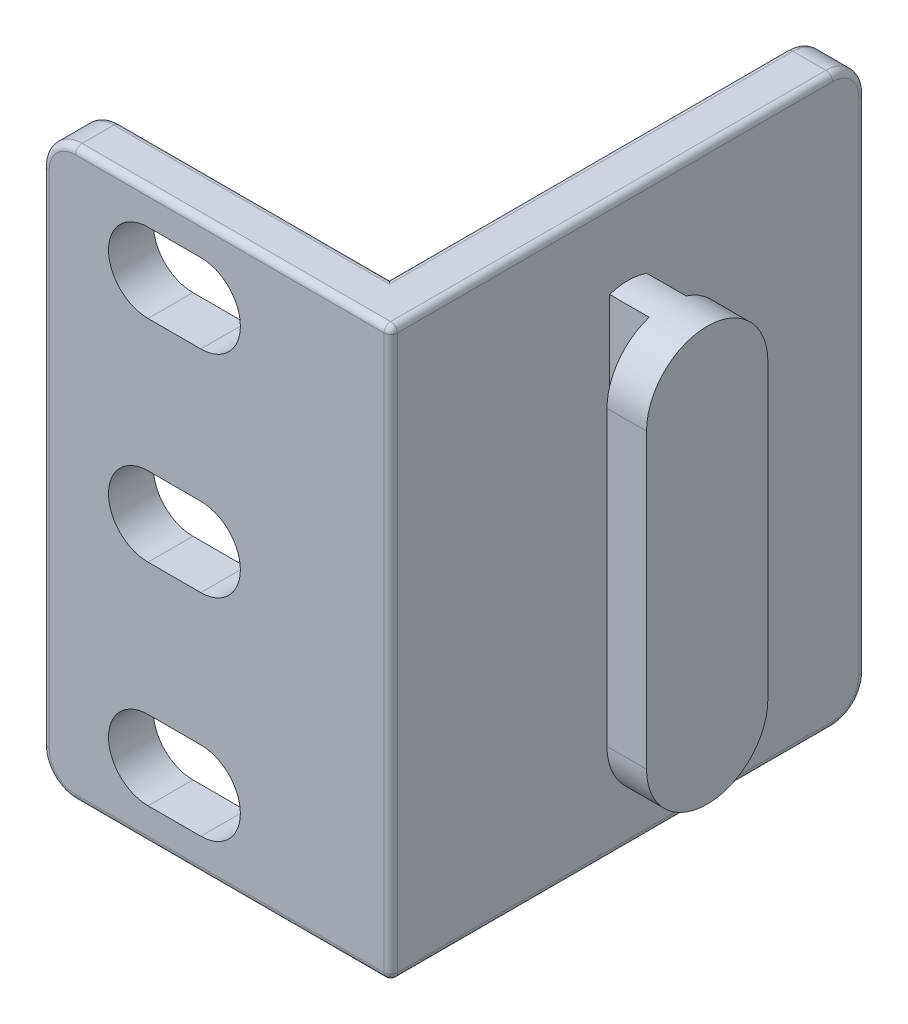
from build123d import *

# Parameters (mm, degrees)
P_IDAT_VYSUNUT_M1_DEPTH  = 21.5
P_IDAT_VYSUNUT_M2_DEPTH  = 3
P_IDAT_VYSUNUT_M3_DEPTH  = 3
ODEBRAT_VYSUNUT_M1_DEPTH = 50.550075681
ZAOBLIT1_R               = 2.5
ZAOBLIT2_R               = 0.5


with BuildPart() as part:
    # Skica2 → Přidat vysunutím1 (new, symmetric)
    with BuildSketch(Plane(origin=(0, 0, 0), x_dir=(1, 0, 0), z_dir=(0, 1, 0))):
        Polygon((0, 0), (-26.4, 0), (-26.4, 3.4), (-3.5, 3.4), (-3.5, 36), (0, 36), align=None)
    extrude(amount=P_IDAT_VYSUNUT_M1_DEPTH, both=True)

    # Skica3 → Přidat vysunutím2 (add)
    with BuildSketch(Plane(origin=(0, 0, 0), x_dir=(0, 0, -1), z_dir=(1, 0, 0))):
        with BuildLine():
            Line((16.6, 15.48178046), (16.6, -15.48178046))
            ThreePointArc((16.6, -15.48178046), (18, -15.7), (19.4, -15.48178046))
            Line((19.4, -15.48178046), (19.4, 15.48178046))
            ThreePointArc((19.4, 15.48178046), (18, 15.7), (16.6, 15.48178046))
        make_face()
    extrude(amount=P_IDAT_VYSUNUT_M2_DEPTH)

    # Skica4 → Přidat vysunutím3 (add)
    with BuildSketch(Plane(origin=(3, 0, 0), x_dir=(0, 0, -1), z_dir=(1, 0, 0))):
        with BuildLine():
            Line((13.4, -11.1), (13.4, 11.1))
            ThreePointArc((13.4, 11.1), (18, 15.7), (22.6, 11.1))
            Line((22.6, 11.1), (22.6, -11.1))
            ThreePointArc((22.6, -11.1), (18, -15.7), (13.4, -11.1))
        make_face()
    extrude(amount=P_IDAT_VYSUNUT_M3_DEPTH)

    # Skica5 → Odebrat vysunutím1 (cut, through all)
    with BuildSketch(Plane.XY):
        with BuildLine():
            Line((-14.400164981, -3), (-18.399835019, -3))
            ThreePointArc((-18.399835019, -3), (-21.399835019, 0), (-18.399835019, 3))
            Line((-18.399835019, 3), (-14.400164981, 3))
            ThreePointArc((-14.400164981, 3), (-11.400164981, 0), (-14.400164981, -3))
        make_face()
        with BuildLine():
            Line((-14.400164981, 13), (-18.399835019, 13))
            ThreePointArc((-18.399835019, 13), (-21.399835019, 16), (-18.399835019, 19))
            Line((-18.399835019, 19), (-14.400164981, 19))
            ThreePointArc((-14.400164981, 19), (-11.400164981, 16), (-14.400164981, 13))
        make_face()
        with BuildLine():
            Line((-14.400164981, -19), (-18.399835019, -19))
            ThreePointArc((-18.399835019, -19), (-21.399835019, -16), (-18.399835019, -13))
            Line((-18.399835019, -13), (-14.400164981, -13))
            ThreePointArc((-14.400164981, -13), (-11.400164981, -16), (-14.400164981, -19))
        make_face()
    extrude(amount=-ODEBRAT_VYSUNUT_M1_DEPTH, mode=Mode.SUBTRACT)

    # Zaoblit1
    zaoblit1_edges = [part.edges().sort_by_distance(p)[0] for p in [
        (-26.4, 21.5, -1.7),
        (-26.4, -21.5, -1.7),
        (-1.75, 21.5, -36),
        (-1.75, -21.5, -36),
    ]]
    fillet(zaoblit1_edges, radius=ZAOBLIT1_R)

    # Zaoblit2
    zaoblit2_edges = [part.edges().sort_by_distance(p)[0] for p in [
        (0, 0, 0),
        (-26.4, 0, 0),
        (-26.4, 0, -3.4),
        (-11.95, -21.5, 0),
        (-11.95, 21.5, 0),
        (-25.667766953, 20.767766953, 0),
        (-25.667766953, -20.767766953, 0),
        (-3.5, -21.5, -18.45),
        (-25.667766953, 20.767766953, -3.4),
        (-25.667766953, -20.767766953, -3.4),
        (-3.5, 21.5, -18.45),
        (-3.5, 0, -36),
        (0, 0, -36),
        (-3.5, 20.767766953, -35.267766953),
        (-3.5, -20.767766953, -35.267766953),
        (0, 20.767766953, -35.267766953),
        (0, -20.767766953, -35.267766953),
        (-13.7, 21.5, -3.4),
        (0, 21.5, -16.75),
        (-13.7, -21.5, -3.4),
        (0, -21.5, -16.75),
    ]]
    fillet(zaoblit2_edges, radius=ZAOBLIT2_R)


solid = part.part
